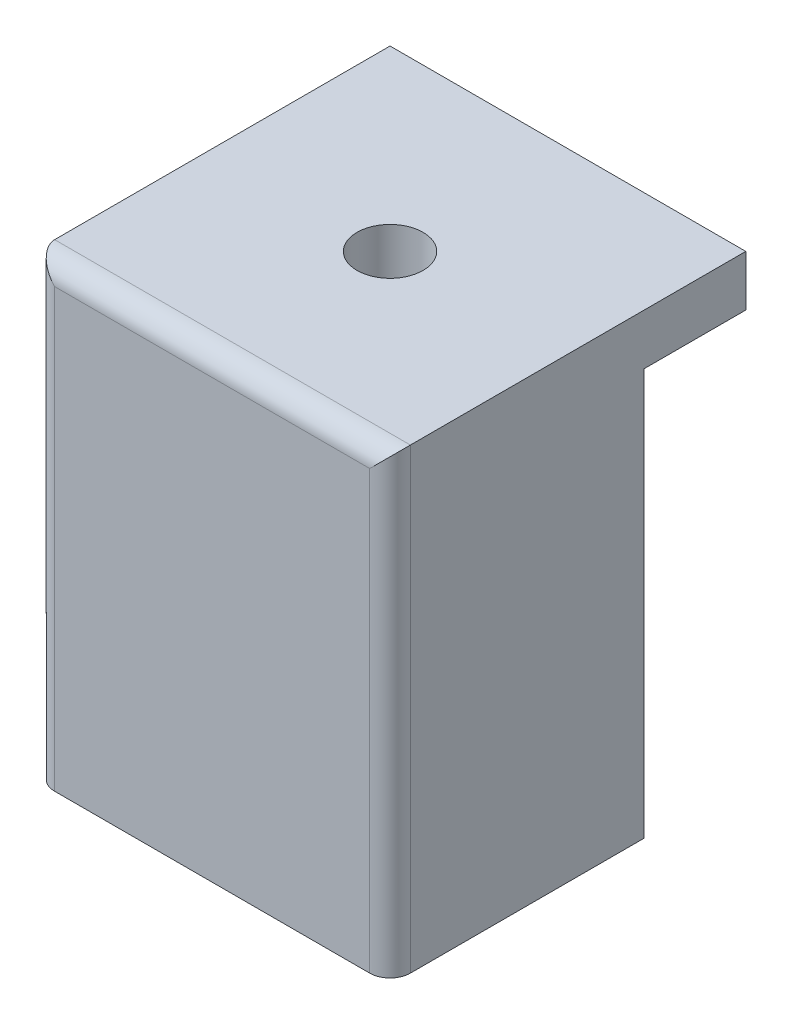
from build123d import *

# Parameters (mm, degrees)
BOSS_EXTRUDE1_DEPTH = 45
SKETCH2_W           = 15
SKETCH2_H           = 10
BOSS_EXTRUDE2_DEPTH = 15
CUT_EXTRUDE1_START  = -35
SKETCH3_R           = 3.25
CUT_EXTRUDE1_DEPTH  = 35
SKETCH4_W           = 35
SKETCH4_H           = 5
BOSS_EXTRUDE3_DEPTH = 10
FILLET1_R           = 2


with BuildPart() as part:
    # Sketch1 → Boss-Extrude1 (new body)
    with BuildSketch(Plane(origin=(0, 0, 0), x_dir=(1, 0, 0), z_dir=(0, 1, 0))):
        Polygon((-17.5, 7.5), (-7.5, 7.5), (-7.5, -7.5), (7.5, -7.5), (7.5, 7.5), (17.5, 7.5), (17.5, -17.5), (-17.5, -17.5), align=None)
    extrude(amount=BOSS_EXTRUDE1_DEPTH)

    # Sketch2 → Boss-Extrude2 (add)
    with BuildSketch(Plane(origin=(0, 0, 7.5), x_dir=(-1, 0, 0), z_dir=(0, 0, -1))):
        with Locations((0, 40)):
            Rectangle(SKETCH2_W, SKETCH2_H)
        with Locations((0, 15)):
            Rectangle(SKETCH2_W, SKETCH2_H)
    extrude(amount=BOSS_EXTRUDE2_DEPTH)

    # Sketch3 → Cut-Extrude1 (cut)
    with BuildSketch(Plane(origin=(0, 45, 0), x_dir=(1, 0, 0), z_dir=(0, 1, 0)).offset(CUT_EXTRUDE1_START)):
        with Locations(Location((0, 0, 0), (0, 0, 270))):
            Circle(SKETCH3_R)
    extrude(amount=CUT_EXTRUDE1_DEPTH, mode=Mode.SUBTRACT)

    # Sketch4 → Boss-Extrude3 (add)
    with BuildSketch(Plane(origin=(0, 0, -7.5), x_dir=(-1, 0, 0), z_dir=(0, 0, -1))):
        with Locations((0, 42.5)):
            Rectangle(SKETCH4_W, SKETCH4_H)
    extrude(amount=BOSS_EXTRUDE3_DEPTH)

    # Fillet1
    fillet1_edges = [part.edges().sort_by_distance(p)[0] for p in [
        (17.5, 22.5, 17.5),
        (-17.5, 22.5, 17.5),
        (0, 45, 17.5),
    ]]
    fillet(fillet1_edges, radius=FILLET1_R)


solid = part.part
